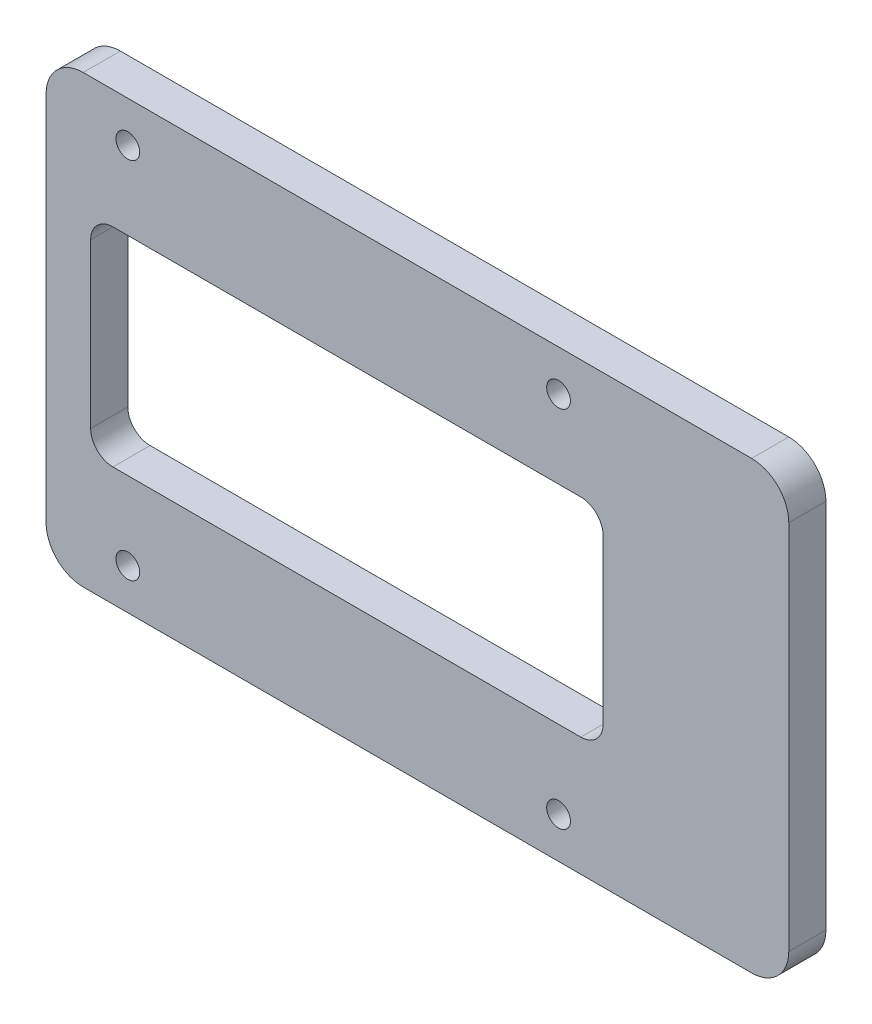
from build123d import *

# Parameters (mm, degrees)
SKETCH_1_R      = 1.6
EXTRUDE_1_DEPTH = 5


with BuildPart() as part:
    # 草图1 → 凸台-拉伸1 (new body)
    with BuildSketch(Plane.XY):
        with BuildLine():
            Line((-45, 30), (45, 30))
            ThreePointArc((45, 30), (48.535533906, 28.535533906), (50, 25))
            Line((50, 25), (50, -25))
            ThreePointArc((50, -25), (48.535533906, -28.535533906), (45, -30))
            Line((45, -30), (-45, -30))
            ThreePointArc((-45, -30), (-48.535533906, -28.535533906), (-50, -25))
            Line((-50, -25), (-50, 25))
            ThreePointArc((-50, 25), (-48.535533906, 28.535533906), (-45, 30))
        make_face()
        with Locations((-39, 24.5)):
            Circle(SKETCH_1_R, mode=Mode.SUBTRACT)
        with Locations((19, 24.5)):
            Circle(SKETCH_1_R, mode=Mode.SUBTRACT)
        with Locations((19, -24.5)):
            Circle(SKETCH_1_R, mode=Mode.SUBTRACT)
        with Locations((-39, -24.5)):
            Circle(SKETCH_1_R, mode=Mode.SUBTRACT)
        with BuildLine():
            Line((-41, 14), (22, 14))
            ThreePointArc((22, 14), (24.121320344, 13.121320344), (25, 11))
            Line((25, 11), (25, -11))
            ThreePointArc((25, -11), (24.121320344, -13.121320344), (22, -14))
            Line((22, -14), (-41, -14))
            ThreePointArc((-41, -14), (-43.121320344, -13.121320344), (-44, -11))
            Line((-44, -11), (-44, 11))
            ThreePointArc((-44, 11), (-43.121320344, 13.121320344), (-41, 14))
        make_face(mode=Mode.SUBTRACT)
    extrude(amount=EXTRUDE_1_DEPTH)


solid = part.part
